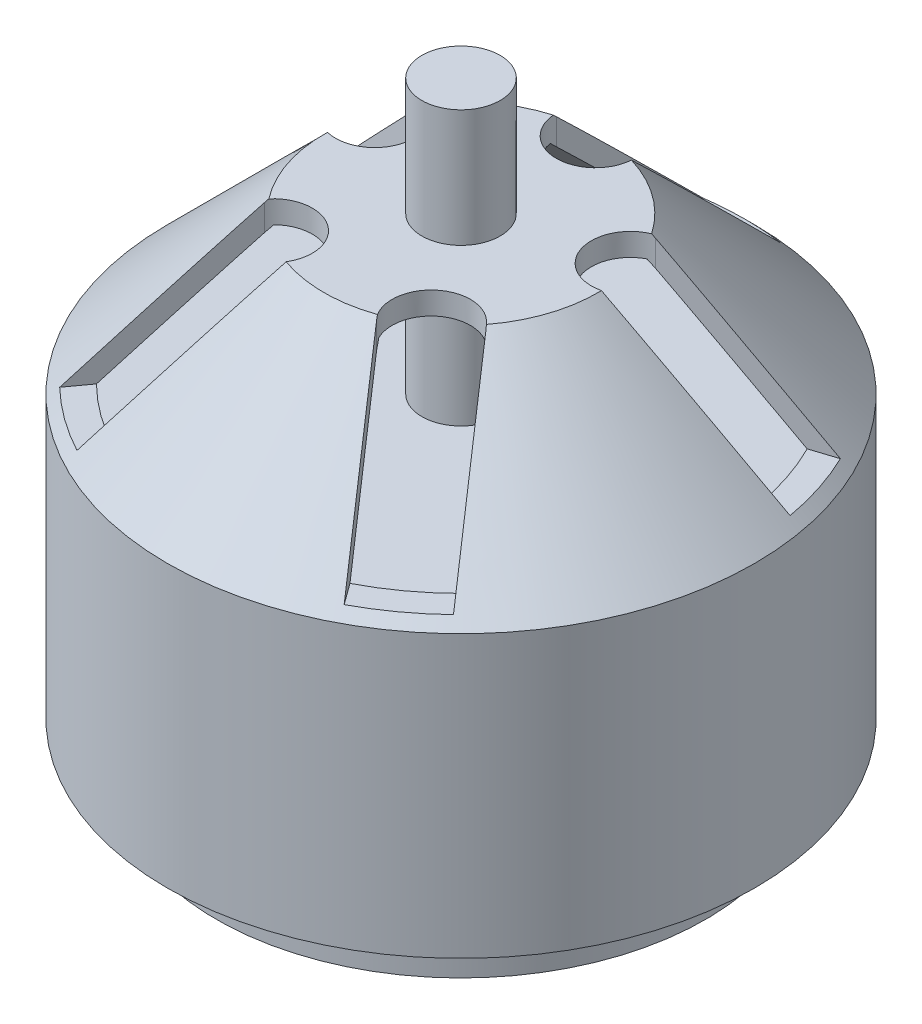
from build123d import *

# Parameters (mm, degrees)
CUT_EXTRUDE1_DEPTH = 15


with BuildPart() as part:
    # Sketch1 → Revolve1 (revolve)
    with BuildSketch(Plane.XY, mode=Mode.PRIVATE) as revolve1_sk:
        Polygon((0, 0), (0, 62), (4, 62), (4, 50), (14.011376117, 50), (30, 34.011376117), (30, 5.271229558), (25, 5.271229558), (25, 0), align=None)
        Polygon((4, 47.694049141), (13.654762603, 47.694049141), (27.337435628, 34.011376117), (4, 34.011376117), align=None, mode=Mode.SUBTRACT)
    revolve(revolve1_sk.sketch.rotate(Axis((0, 0, 0), (0, 1, 0)), 90), axis=Axis((0, 0, 0), (0, 1, 0)))

    # Sketch2 → Cut-Extrude1 (cut)
    with BuildSketch(Plane(origin=(0, 50, 0), x_dir=(1, 0, 0), z_dir=(0, 1, 0))):
        with BuildLine():
            Line((-4, 13.743876759), (-4, 37.242755883))
            Line((-4, 37.242755883), (4, 37.242755883))
            Line((4, 37.242755883), (4, 13.743876759))
            ThreePointArc((4, 13.743876759), (0, 9.743876759), (-4, 13.743876759))
        make_face()
        with BuildLine():
            Line((11.835135573, 8.051317552), (34.18389769, 15.312870551))
            Line((34.18389769, 15.312870551), (36.656033645, 7.70441842))
            Line((36.656033645, 7.70441842), (14.307271528, 0.442865422))
            ThreePointArc((14.307271528, 0.442865422), (9.266977486, 3.01102351), (11.835135573, 8.051317552))
        make_face()
        with BuildLine():
            Line((11.314516046, -8.767888857), (25.126810641, -27.778881418))
            Line((25.126810641, -27.778881418), (18.654674686, -32.481163436))
            Line((18.654674686, -32.481163436), (4.842380091, -13.470170876))
            ThreePointArc((4.842380091, -13.470170876), (5.727307059, -7.882961889), (11.314516046, -8.767888857))
        make_face()
        with BuildLine():
            Line((-4.842380091, -13.470170876), (-18.654674686, -32.481163436))
            Line((-18.654674686, -32.481163436), (-25.126810641, -27.778881418))
            Line((-25.126810641, -27.778881418), (-11.314516046, -8.767888857))
            ThreePointArc((-11.314516046, -8.767888857), (-5.727307059, -7.882961889), (-4.842380091, -13.470170876))
        make_face()
        with BuildLine():
            Line((-14.307271528, 0.442865422), (-36.656033645, 7.70441842))
            Line((-36.656033645, 7.70441842), (-34.18389769, 15.312870551))
            Line((-34.18389769, 15.312870551), (-11.835135573, 8.051317552))
            ThreePointArc((-11.835135573, 8.051317552), (-9.266977486, 3.01102351), (-14.307271528, 0.442865422))
        make_face()
    extrude(amount=-CUT_EXTRUDE1_DEPTH, mode=Mode.SUBTRACT)


solid = part.part
